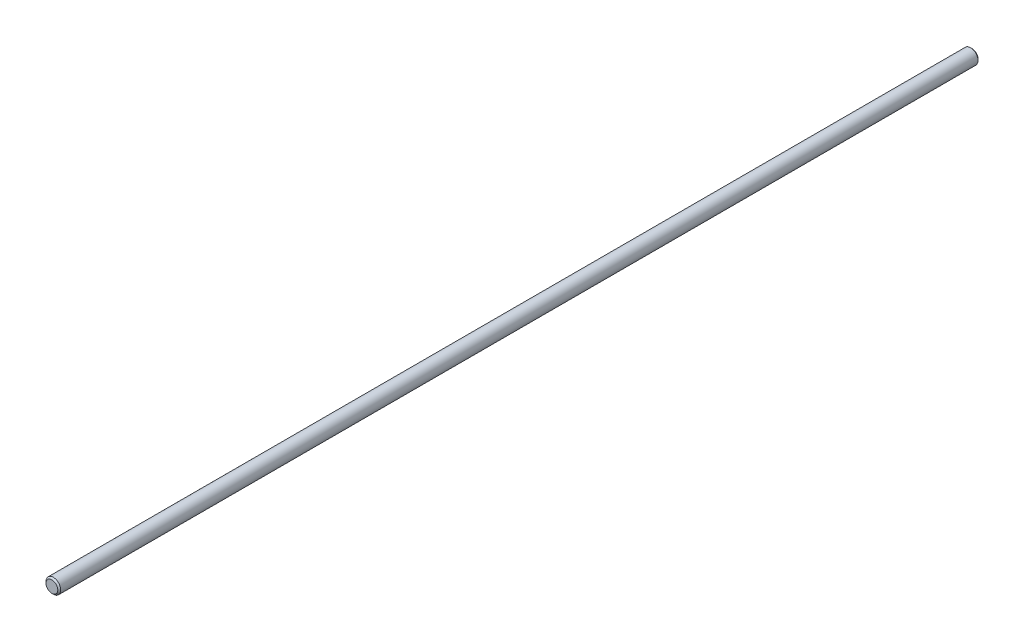
from build123d import *

# Parameters (mm, degrees)
SKETCH1_R      = 4
EXTRUDE1_DEPTH = 250
CHAMFER1_SIZE  = 0.8


with BuildPart() as part:
    # Sketch1 → Extrude1 (new, symmetric)
    with BuildSketch(Plane.XY):
        Circle(SKETCH1_R)
    extrude(amount=EXTRUDE1_DEPTH, both=True)

    # Chamfer1
    chamfer1_edges = [part.edges().sort_by_distance(p)[0] for p in [
        (-4, 0, -250),
        (-4, 0, 250),
    ]]
    chamfer(chamfer1_edges, length=CHAMFER1_SIZE)


solid = part.part
